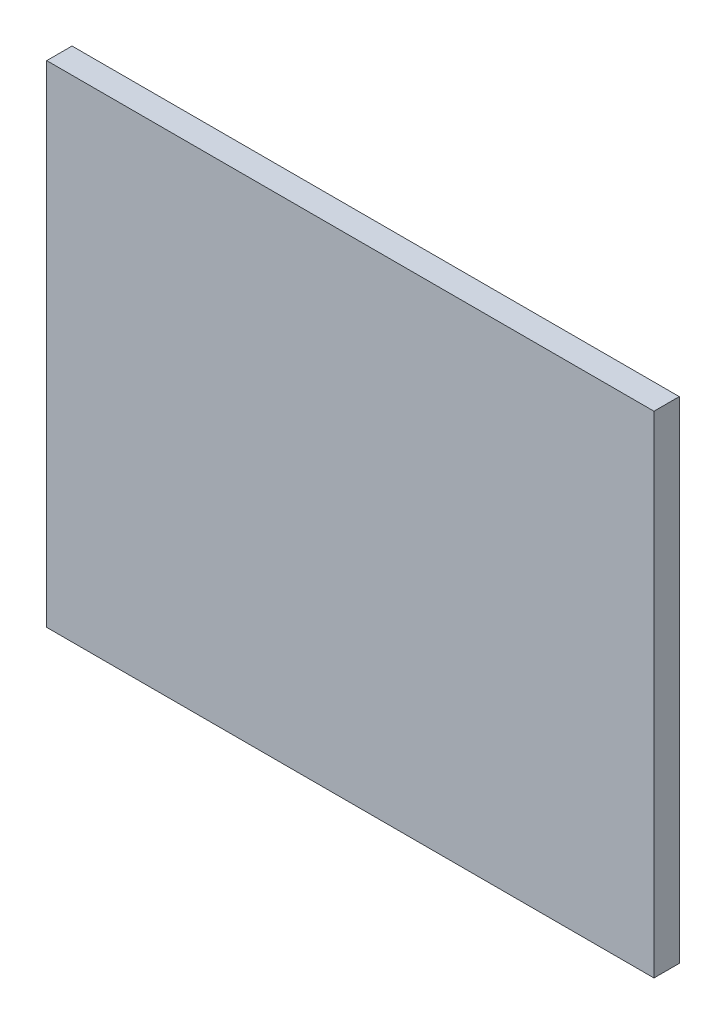
from build123d import *

# Parameters (mm, degrees)
SKETCH1_W           = 120
SKETCH1_H           = 97
BOSS_EXTRUDE1_DEPTH = 5


with BuildPart() as part:
    # Sketch1 → Boss-Extrude1 (new body)
    with BuildSketch(Plane.XY):
        with Locations((-9.077490775, -7.909594096)):
            Rectangle(SKETCH1_W, SKETCH1_H)
    extrude(amount=BOSS_EXTRUDE1_DEPTH)


solid = part.part
